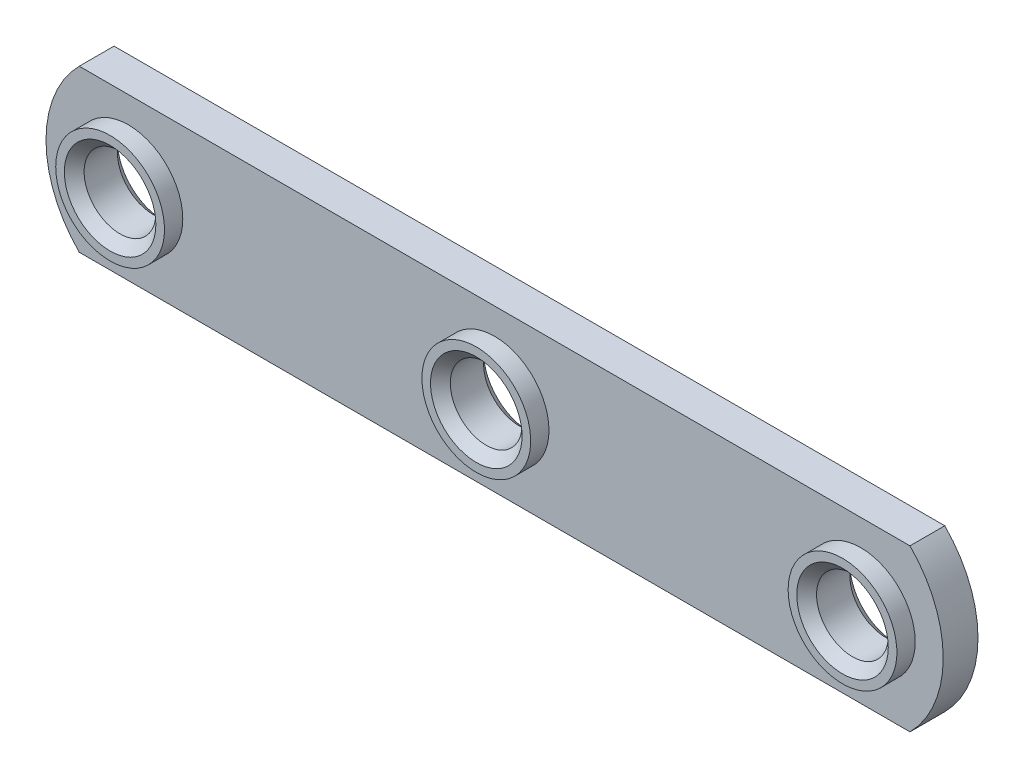
from build123d import *

# Parameters (mm, degrees)
BOSS_EXTRUDE1_DEPTH = 2.413
SKETCH2_W           = 3.7719
SKETCH2_H           = 1.27
SKETCH3_W           = 3.7719
SKETCH3_H           = 1.27
SKETCH4_W           = 3.7719
SKETCH4_H           = 1.27
HOLE1_D             = 4.97586
HOLE1_CSINK_D       = 6.35
HOLE1_CSINK_ANGLE   = 90
CHAMFER1_SIZE       = 0.68707


with BuildPart() as part:
    # Sketch1 → Boss-Extrude1 (new body)
    with BuildSketch(Plane.XY.offset(1.2065)):
        with BuildLine():
            Line((54.209515887, 5.588), (-3.409515887, 5.588))
            ThreePointArc((-3.409515887, 5.588), (-5.715, 0), (-3.409515887, -5.588))
            Line((-3.409515887, -5.588), (54.209515887, -5.588))
            ThreePointArc((54.209515887, -5.588), (56.515, 0), (54.209515887, 5.588))
        make_face()
    extrude(amount=-BOSS_EXTRUDE1_DEPTH)

    # Sketch2 → Revolve1 (revolve)
    with BuildSketch(Plane.XZ, mode=Mode.PRIVATE) as revolve1_sk:
        with Locations((27.28595, 1.8415)):
            Rectangle(SKETCH2_W, SKETCH2_H)
    revolve(revolve1_sk.sketch.rotate(Axis((25.4, 0, 2.4765), (0, 0, -1)), 180), axis=Axis((25.4, 0, 2.4765), (0, 0, -1)))

    # Sketch3 → Revolve2 (revolve)
    with BuildSketch(Plane.XZ, mode=Mode.PRIVATE) as revolve2_sk:
        with Locations((1.88595, 1.8415)):
            Rectangle(SKETCH3_W, SKETCH3_H)
    revolve(revolve2_sk.sketch.rotate(Axis((0, 0, 2.4765), (0, 0, -1)), 180), axis=Axis((0, 0, 2.4765), (0, 0, -1)))

    # Sketch4 → Revolve3 (revolve)
    with BuildSketch(Plane.XZ, mode=Mode.PRIVATE) as revolve3_sk:
        with Locations((52.68595, 1.8415)):
            Rectangle(SKETCH4_W, SKETCH4_H)
    revolve(revolve3_sk.sketch.rotate(Axis((50.8, 0, 2.4765), (0, 0, -1)), 180), axis=Axis((50.8, 0, 2.4765), (0, 0, -1)))

    # Hole1 (through all)
    with Locations(Plane.XY.offset(2.4765)):
        with Locations((0, 0), (25.4, 0), (50.8, 0)):
            CounterSinkHole(HOLE1_D / 2, HOLE1_CSINK_D / 2, counter_sink_angle=HOLE1_CSINK_ANGLE)

    # Chamfer1
    chamfer1_edges = [part.edges().sort_by_distance(p)[0] for p in [
        (53.28793, 0, -1.2065),
        (27.88793, 0, -1.2065),
        (2.48793, 0, -1.2065),
    ]]
    chamfer(chamfer1_edges, length=CHAMFER1_SIZE)


solid = part.part
